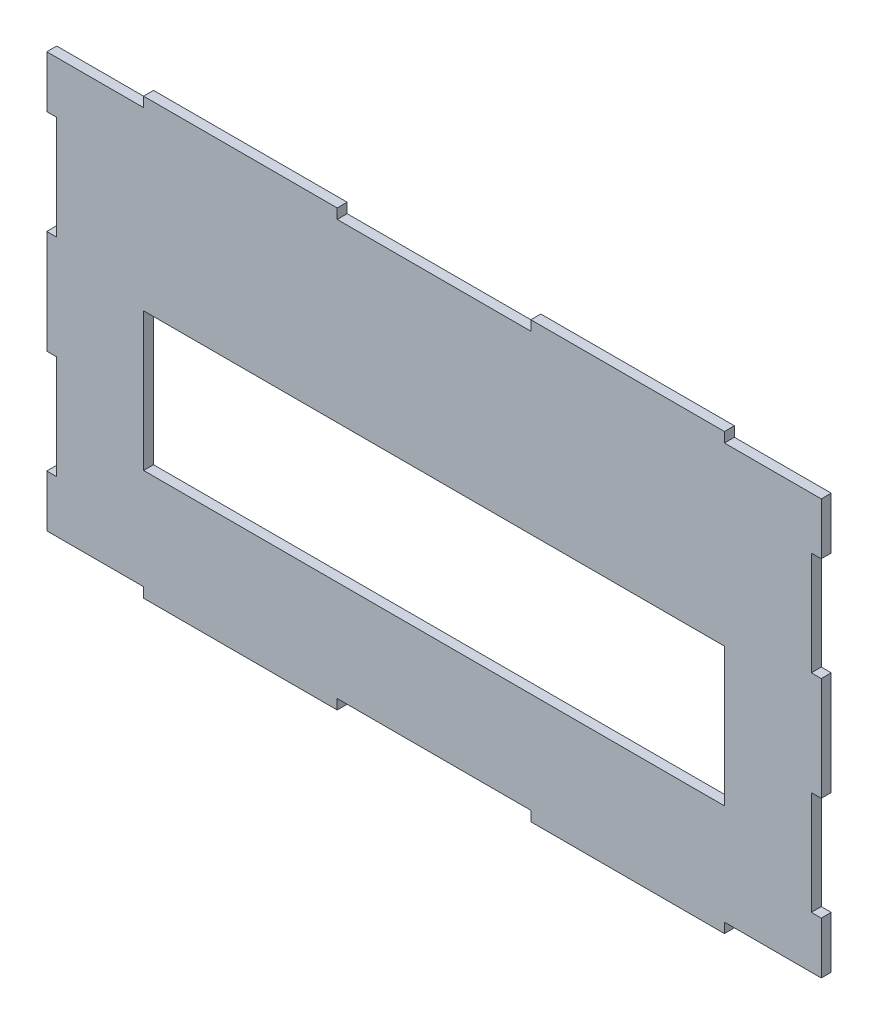
from build123d import *

# Parameters (mm, degrees)
EXTRUDE_1_DEPTH     = 3.6
SKETCH_2_W          = 210
SKETCH_2_H          = 50
CUT_EXTRUDE_1_DEPTH = 10


with BuildPart() as part:
    # 草图1 → 凸台-拉伸1 (new body)
    with BuildSketch(Plane.XY):
        Polygon((140, -75), (105, -75), (105, -78.6), (35, -78.6), (35, -75), (-35, -75), (-35, -78.6), (-105, -78.6), (-105, -75), (-140, -75), (-140, -56.25), (-136.4, -56.25), (-136.4, -18.75), (-140, -18.75), (-140, 18.75), (-136.4, 18.75), (-136.4, 56.25), (-140, 56.25), (-140, 75), (-105, 75), (-105, 78.6), (-35, 78.6), (-35, 75), (35, 75), (35, 78.6), (105, 78.6), (105, 75), (140, 75), (140, 56.25), (136.4, 56.25), (136.4, 18.75), (140, 18.75), (140, -18.75), (136.4, -18.75), (136.4, -56.25), (140, -56.25), align=None)
    extrude(amount=EXTRUDE_1_DEPTH)

    # 草图2 → 切除-拉伸1 (cut)
    with BuildSketch(Plane.XY.offset(3.6)):
        with Locations((0, -13.6)):
            Rectangle(SKETCH_2_W, SKETCH_2_H)
    extrude(amount=-CUT_EXTRUDE_1_DEPTH, mode=Mode.SUBTRACT)


solid = part.part
